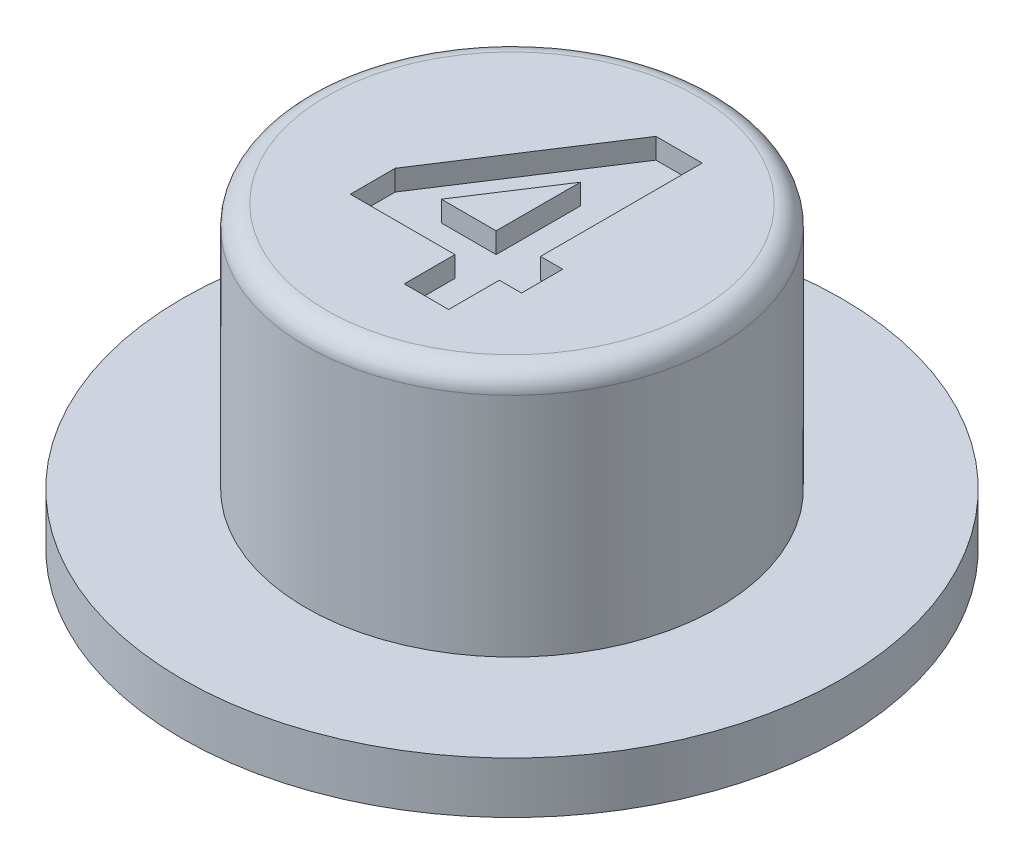
from build123d import *

# Parameters (mm, degrees)
SKETCH2_W          = 2.5
SKETCH2_H          = 3.5
CUT_EXTRUDE1_DEPTH = 3.5
FILLET1_R          = 0.5
CUT_EXTRUDE2_DEPTH = 0.5


with BuildPart() as part:
    # Sketch1 → Revolve1 (revolve)
    with BuildSketch(Plane.XY, mode=Mode.PRIVATE) as revolve1_sk:
        Polygon((0, 7.25), (5, 7.25), (5, 1.25), (8, 1.25), (8, 0), (0, 0), align=None)
    revolve(revolve1_sk.sketch.rotate(Axis((0, 7.25, 0), (0, -1, 0)), 180), axis=Axis((0, 7.25, 0), (0, -1, 0)))

    # Sketch2 → Cut-Extrude1 (cut)
    with BuildSketch(Plane.XZ):
        Rectangle(SKETCH2_W, SKETCH2_H)
    extrude(amount=-CUT_EXTRUDE1_DEPTH, mode=Mode.SUBTRACT)

    # Fillet1
    fillet1_edges = [part.edges().sort_by_distance(p)[0] for p in [
        (5, 7.25, 0),
    ]]
    fillet(fillet1_edges, radius=FILLET1_R)

    # Sketch3 → Cut-Extrude2 (cut)
    with BuildSketch(Plane(origin=(0, 7.25, 0), x_dir=(1, 0, 0), z_dir=(0, 1, 0))):
        Polygon((0.338942308, 3.153846154), (1.461538462, 3.153846154), (1.461538462, -0.769230769), (2, -0.769230769), (2, -1.769230769), (1.461538462, -1.769230769), (1.461538462, -3), (0.384615385, -3), (0.384615385, -1.769230769), (-2.153846154, -1.769230769), (-2.153846154, -0.679086538), align=None)
        Polygon((0.384615385, -0.769230769), (0.384615385, 1.272836538), (-0.943509615, -0.769230769), align=None, mode=Mode.SUBTRACT)
    extrude(amount=-CUT_EXTRUDE2_DEPTH, mode=Mode.SUBTRACT)


solid = part.part
